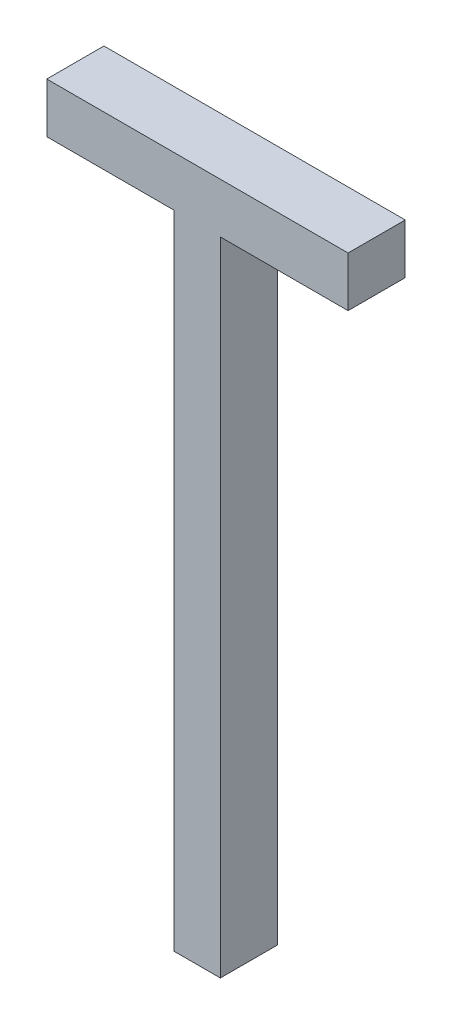
from build123d import *

# Parameters (mm, degrees)
SKETCH_1_W      = 210.784586304
SKETCH_1_H      = 34.954573272
SKETCH_1_W_2    = 32.498755693
SKETCH_1_H_2    = 448.960004708
EXTRUDE_1_DEPTH = 40


with BuildPart() as part:
    # Эскиз1 → Бобышка-Вытянуть1 (new body)
    with BuildSketch(Plane.XY):
        with Locations((16.455339243, 94.687691672)):
            Rectangle(SKETCH_1_W, SKETCH_1_H)
        with Locations((16.249377846, -147.269597318)):
            Rectangle(SKETCH_1_W_2, SKETCH_1_H_2)
    extrude(amount=EXTRUDE_1_DEPTH)


solid = part.part
